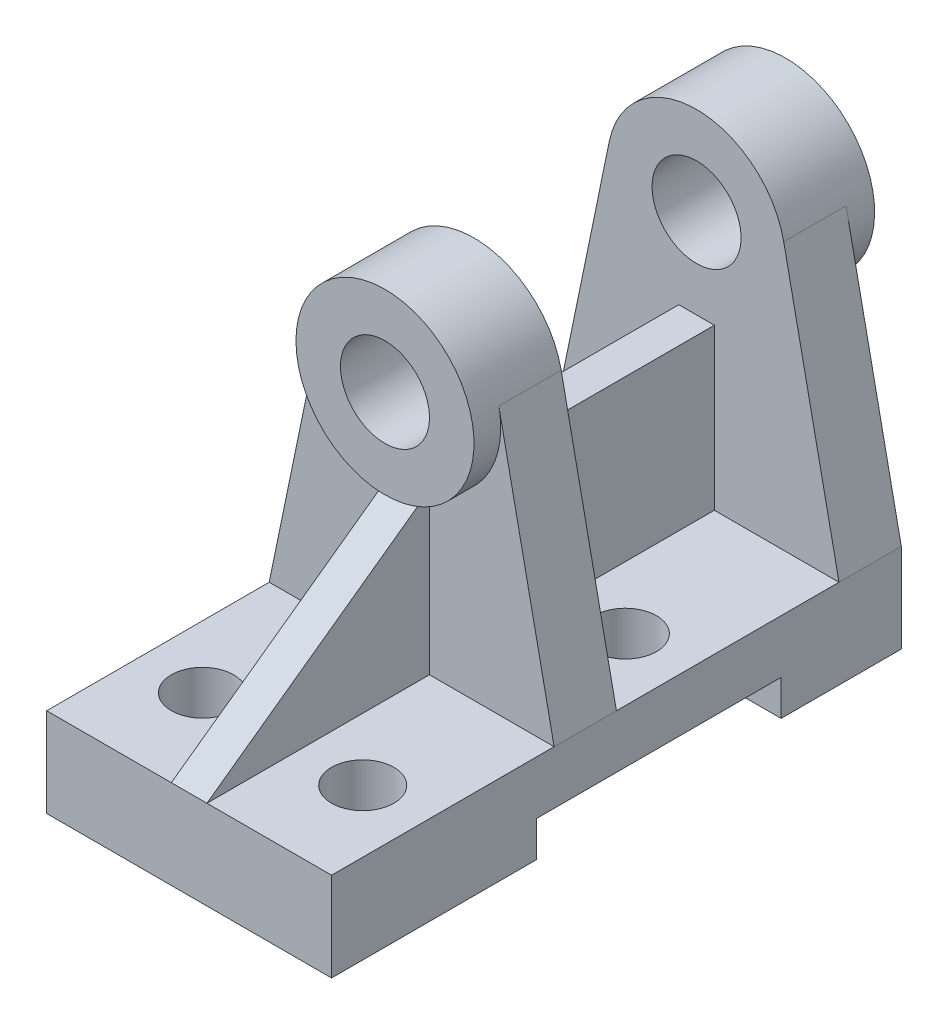
from build123d import *

# Parameters (mm, degrees)
SKETCH1_W                = 64
SKETCH1_H                = 128
BOSS_EXTRUDE1_DEPTH      = 20
BOSS_EXTRUDE2_DEPTH      = 14
BOSS_EXTRUDE3_DEPTH      = 6
BOSS_EXTRUDE3_DEPTH_BACK = 14
SKETCH2_3_R              = 10
BOSS_EXTRUDE4_START      = -70
SKETCH4_R                = 20
SKETCH4_R_2              = 10
BOSS_EXTRUDE4_DEPTH      = 20
BOSS_EXTRUDE5_START      = -78
BOSS_EXTRUDE5_DEPTH      = 14
SKETCH8_W                = 64
SKETCH8_H                = 55
CUT_EXTRUDE1_DEPTH       = 8
SKETCH6_W                = 50
SKETCH6_H                = 36
BOSS_EXTRUDE6_DEPTH      = 4
SKETCH7_R                = 7
CUT_EXTRUDE2_DEPTH       = 109.166538264


with BuildPart() as part:
    # Sketch1 → Boss-Extrude1 (new body)
    with BuildSketch(Plane(origin=(0, 0, 0), x_dir=(1, 0, 0), z_dir=(0, 1, 0))):
        Rectangle(SKETCH1_W, SKETCH1_H)
    extrude(amount=BOSS_EXTRUDE1_DEPTH)

    # Sketch2 → Boss-Extrude2 (add)
    with BuildSketch(Plane(origin=(0, 0, -64), x_dir=(-1, 0, 0), z_dir=(0, 0, -1))):
        with BuildLine():
            Line((-19.585841233, 80.049052133), (-32, 20))
            Line((-32, 20), (32, 20))
            Line((32, 20), (19.585841233, 80.049052133))
            ThreePointArc((19.585841233, 80.049052133), (19.8961909, 78.035089105), (20, 76))
            ThreePointArc((20, 76), (-2.035089105, 56.1038091), (-19.585841233, 80.049052133))
        make_face()
    extrude(amount=-BOSS_EXTRUDE2_DEPTH)

    # Sketch2<3> → Boss-Extrude3 (add, two sides: drawn at the far end of the back side and taken through both)
    with BuildSketch(Plane(origin=(0, 0, -64), x_dir=(-1, 0, 0), z_dir=(0, 0, -1)).offset(-BOSS_EXTRUDE3_DEPTH_BACK)):
        with BuildLine():
            ThreePointArc((19.585841233, 80.049052133), (0, 96), (-19.585841233, 80.049052133))
            ThreePointArc((-19.585841233, 80.049052133), (-2.035089105, 56.1038091), (20, 76))
            ThreePointArc((20, 76), (19.8961909, 78.035089105), (19.585841233, 80.049052133))
        make_face()
        with Locations((0, 76)):
            Circle(SKETCH2_3_R, mode=Mode.SUBTRACT)
    extrude(amount=BOSS_EXTRUDE3_DEPTH + BOSS_EXTRUDE3_DEPTH_BACK)



with BuildPart() as body_2:
    # Sketch4 → Boss-Extrude4 (new body)
    with BuildSketch(Plane(origin=(0, 0, -70), x_dir=(-1, 0, 0), z_dir=(0, 0, -1)).offset(BOSS_EXTRUDE4_START)):
        with Locations((0, 76)):
            Circle(SKETCH4_R)
        with Locations((0, 76)):
            Circle(SKETCH4_R_2, mode=Mode.SUBTRACT)
    extrude(amount=-BOSS_EXTRUDE4_DEPTH)


with BuildPart() as part_1:
    add(part.part)

    add(body_2.part)  # Boss-Extrude5 merges body 2
    # Sketch5 → Boss-Extrude5 (add)
    with BuildSketch(Plane(origin=(0, 0, -64), x_dir=(-1, 0, 0), z_dir=(0, 0, -1)).offset(BOSS_EXTRUDE5_START)):
        with BuildLine():
            Line((32, 20), (19.585841233, 80.049052133))
            ThreePointArc((19.585841233, 80.049052133), (0, 56), (-19.585841233, 80.049052133))
            Line((-19.585841233, 80.049052133), (-32, 20))
            Line((-32, 20), (32, 20))
        make_face()
    extrude(amount=BOSS_EXTRUDE5_DEPTH)

    # Sketch8 → Cut-Extrude1 (cut)
    with BuildSketch(Plane.XZ):
        with Locations((0, -9.5)):
            Rectangle(SKETCH8_W, SKETCH8_H)
    extrude(amount=-CUT_EXTRUDE1_DEPTH, mode=Mode.SUBTRACT)

    # Sketch6 → Boss-Extrude6 (add, symmetric)
    with BuildSketch(Plane(origin=(0, 0, 0), x_dir=(0, 0, -1), z_dir=(1, 0, 0))):
        Polygon((-64, 20), (-14, 20), (-14, 56), align=None)
        with Locations((25, 38)):
            Rectangle(SKETCH6_W, SKETCH6_H)
    extrude(amount=BOSS_EXTRUDE6_DEPTH, both=True)

    # Sketch7 → Cut-Extrude2 (cut, through all)
    with BuildSketch(Plane(origin=(0, 20, 0), x_dir=(1, 0, 0), z_dir=(0, 1, 0))):
        with Locations((18, 16)):
            Circle(SKETCH7_R)
        with Locations((-18, 16)):
            Circle(SKETCH7_R)
        with Locations((18, -43)):
            Circle(SKETCH7_R)
        with Locations((-18, -43)):
            Circle(SKETCH7_R)
    extrude(amount=-CUT_EXTRUDE2_DEPTH, mode=Mode.SUBTRACT)


solid = part_1.part
